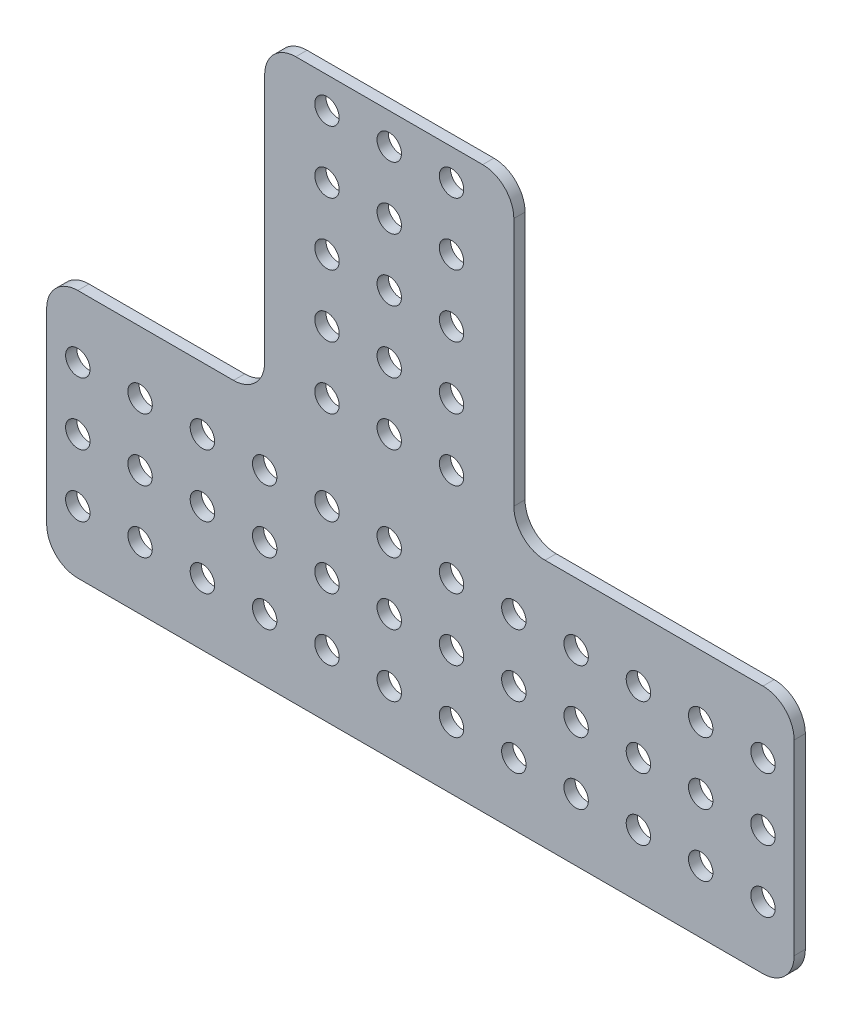
from build123d import *

# Parameters (mm, degrees)
SKETCH1_R           = 2.4892
BOSS_EXTRUDE1_DEPTH = 2.286


with BuildPart() as part:
    # Sketch1 → Boss-Extrude1 (new body)
    with BuildSketch(Plane.XY):
        with BuildLine():
            Line((-258.218407496, 188.842880428), (-220.118407496, 188.842880428))
            ThreePointArc((-220.118407496, 188.842880428), (-215.628279435, 186.983008489), (-213.768407496, 182.492880428))
            Line((-213.768407496, 182.492880428), (-213.768407496, 131.692880428))
            ThreePointArc((-213.768407496, 131.692880428), (-211.908535556, 127.202752368), (-207.418407496, 125.342880428))
            Line((-207.418407496, 125.342880428), (-162.968407496, 125.342880428))
            ThreePointArc((-162.968407496, 125.342880428), (-158.478279435, 123.483008489), (-156.618407496, 118.992880428))
            Line((-156.618407496, 118.992880428), (-156.618407496, 80.892880428))
            ThreePointArc((-156.618407496, 80.892880428), (-158.478279435, 76.402752368), (-162.968407496, 74.542880428))
            Line((-162.968407496, 74.542880428), (-302.668407496, 74.542880428))
            ThreePointArc((-302.668407496, 74.542880428), (-307.158535556, 76.402752368), (-309.018407496, 80.892880428))
            Line((-309.018407496, 80.892880428), (-309.018407496, 118.992880428))
            ThreePointArc((-309.018407496, 118.992880428), (-307.158535556, 123.483008489), (-302.668407496, 125.342880428))
            Line((-302.668407496, 125.342880428), (-270.918407496, 125.342880428))
            ThreePointArc((-270.918407496, 125.342880428), (-266.428279435, 127.202752368), (-264.568407496, 131.692880428))
            Line((-264.568407496, 131.692880428), (-264.568407496, 182.492880428))
            ThreePointArc((-264.568407496, 182.492880428), (-262.708535556, 186.983008489), (-258.218407496, 188.842880428))
        make_face()
        with Locations((-226.468407496, 157.092880428)):
            Circle(SKETCH1_R, mode=Mode.SUBTRACT)
        with Locations((-226.468407496, 144.392880428)):
            Circle(SKETCH1_R, mode=Mode.SUBTRACT)
        with Locations((-226.468407496, 131.692880428)):
            Circle(SKETCH1_R, mode=Mode.SUBTRACT)
        with Locations((-239.168407496, 131.692880428)):
            Circle(SKETCH1_R, mode=Mode.SUBTRACT)
        with Locations((-251.868407496, 131.692880428)):
            Circle(SKETCH1_R, mode=Mode.SUBTRACT)
        with Locations((-251.868407496, 144.392880428)):
            Circle(SKETCH1_R, mode=Mode.SUBTRACT)
        with Locations((-239.168407496, 144.392880428)):
            Circle(SKETCH1_R, mode=Mode.SUBTRACT)
        with Locations((-239.168407496, 157.092880428)):
            Circle(SKETCH1_R, mode=Mode.SUBTRACT)
        with Locations((-251.868407496, 157.092880428)):
            Circle(SKETCH1_R, mode=Mode.SUBTRACT)
        with Locations((-226.468407496, 169.792880428)):
            Circle(SKETCH1_R, mode=Mode.SUBTRACT)
        with Locations((-226.468407496, 182.492880428)):
            Circle(SKETCH1_R, mode=Mode.SUBTRACT)
        with Locations((-239.168407496, 182.492880428)):
            Circle(SKETCH1_R, mode=Mode.SUBTRACT)
        with Locations((-239.168407496, 169.792880428)):
            Circle(SKETCH1_R, mode=Mode.SUBTRACT)
        with Locations((-251.868407496, 169.792880428)):
            Circle(SKETCH1_R, mode=Mode.SUBTRACT)
        with Locations((-251.868407496, 182.492880428)):
            Circle(SKETCH1_R, mode=Mode.SUBTRACT)
        with Locations((-302.668407496, 112.642880428)):
            Circle(SKETCH1_R, mode=Mode.SUBTRACT)
        with Locations((-289.968407496, 112.642880428)):
            Circle(SKETCH1_R, mode=Mode.SUBTRACT)
        with Locations((-277.268407496, 112.642880428)):
            Circle(SKETCH1_R, mode=Mode.SUBTRACT)
        with Locations((-264.568407496, 112.642880428)):
            Circle(SKETCH1_R, mode=Mode.SUBTRACT)
        with Locations((-251.868407496, 112.642880428)):
            Circle(SKETCH1_R, mode=Mode.SUBTRACT)
        with Locations((-239.168407496, 112.642880428)):
            Circle(SKETCH1_R, mode=Mode.SUBTRACT)
        with Locations((-226.468407496, 112.642880428)):
            Circle(SKETCH1_R, mode=Mode.SUBTRACT)
        with Locations((-213.768407496, 112.642880428)):
            Circle(SKETCH1_R, mode=Mode.SUBTRACT)
        with Locations((-201.068407496, 112.642880428)):
            Circle(SKETCH1_R, mode=Mode.SUBTRACT)
        with Locations((-188.368407496, 112.642880428)):
            Circle(SKETCH1_R, mode=Mode.SUBTRACT)
        with Locations((-175.668407496, 112.642880428)):
            Circle(SKETCH1_R, mode=Mode.SUBTRACT)
        with Locations((-162.968407496, 112.642880428)):
            Circle(SKETCH1_R, mode=Mode.SUBTRACT)
        with Locations((-289.968407496, 99.942880428)):
            Circle(SKETCH1_R, mode=Mode.SUBTRACT)
        with Locations((-277.268407496, 99.942880428)):
            Circle(SKETCH1_R, mode=Mode.SUBTRACT)
        with Locations((-264.568407496, 99.942880428)):
            Circle(SKETCH1_R, mode=Mode.SUBTRACT)
        with Locations((-251.868407496, 99.942880428)):
            Circle(SKETCH1_R, mode=Mode.SUBTRACT)
        with Locations((-239.168407496, 99.942880428)):
            Circle(SKETCH1_R, mode=Mode.SUBTRACT)
        with Locations((-226.468407496, 99.942880428)):
            Circle(SKETCH1_R, mode=Mode.SUBTRACT)
        with Locations((-213.768407496, 99.942880428)):
            Circle(SKETCH1_R, mode=Mode.SUBTRACT)
        with Locations((-201.068407496, 99.942880428)):
            Circle(SKETCH1_R, mode=Mode.SUBTRACT)
        with Locations((-188.368407496, 99.942880428)):
            Circle(SKETCH1_R, mode=Mode.SUBTRACT)
        with Locations((-175.668407496, 99.942880428)):
            Circle(SKETCH1_R, mode=Mode.SUBTRACT)
        with Locations((-162.968407496, 99.942880428)):
            Circle(SKETCH1_R, mode=Mode.SUBTRACT)
        with Locations((-289.968407496, 87.242880428)):
            Circle(SKETCH1_R, mode=Mode.SUBTRACT)
        with Locations((-277.268407496, 87.242880428)):
            Circle(SKETCH1_R, mode=Mode.SUBTRACT)
        with Locations((-264.568407496, 87.242880428)):
            Circle(SKETCH1_R, mode=Mode.SUBTRACT)
        with Locations((-251.868407496, 87.242880428)):
            Circle(SKETCH1_R, mode=Mode.SUBTRACT)
        with Locations((-239.168407496, 87.242880428)):
            Circle(SKETCH1_R, mode=Mode.SUBTRACT)
        with Locations((-226.468407496, 87.242880428)):
            Circle(SKETCH1_R, mode=Mode.SUBTRACT)
        with Locations((-213.768407496, 87.242880428)):
            Circle(SKETCH1_R, mode=Mode.SUBTRACT)
        with Locations((-201.068407496, 87.242880428)):
            Circle(SKETCH1_R, mode=Mode.SUBTRACT)
        with Locations((-188.368407496, 87.242880428)):
            Circle(SKETCH1_R, mode=Mode.SUBTRACT)
        with Locations((-175.668407496, 87.242880428)):
            Circle(SKETCH1_R, mode=Mode.SUBTRACT)
        with Locations((-162.968407496, 87.242880428)):
            Circle(SKETCH1_R, mode=Mode.SUBTRACT)
        with Locations((-302.668407496, 99.942880428)):
            Circle(SKETCH1_R, mode=Mode.SUBTRACT)
        with Locations((-302.668407496, 87.242880428)):
            Circle(SKETCH1_R, mode=Mode.SUBTRACT)
    extrude(amount=BOSS_EXTRUDE1_DEPTH)


solid = part.part
